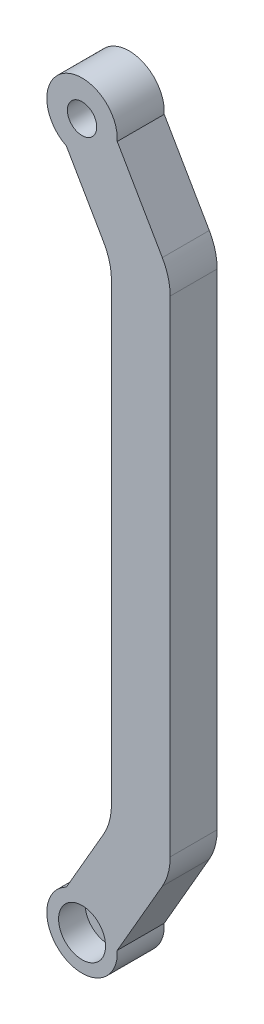
from build123d import *

# Parameters (mm, degrees)
SKETCH_1_R          = 6
EXTRUDE_1_DEPTH     = 8
EXTRUDE_1_2_DEPTH   = 8
EXTRUDE_1_3_DEPTH   = 8
SKETCH_3_R          = 2.5
CUT_EXTRUDE_1_DEPTH = 128.141653285
SKETCH_4_R          = 2
CUT_EXTRUDE_2_DEPTH = 128.141653285
SKETCH_5_R          = 4
CUT_EXTRUDE_3_DEPTH = 4.5
FILLET_1_R          = 10


with BuildPart() as part:
    # 草图1 → Extrude 1 (new body)
    with BuildSketch(Plane.XY):
        Circle(SKETCH_1_R)
    extrude(amount=EXTRUDE_1_DEPTH)



with BuildPart() as body_2:
    # 草图1 → Extrude 1 2 (new body)
    with BuildSketch(Plane.XY):
        with Locations((0, 120)):
            Circle(SKETCH_1_R)
    extrude(amount=EXTRUDE_1_2_DEPTH)


with BuildPart() as part_1:
    add(part.part)

    add(body_2.part)  # Extrude 1 3 merges body 2
    # 草图2 → Extrude 1 3 (add)
    with BuildSketch(Plane.XY):
        Polygon((-4.330127019, 117.5), (5, 101.339745962), (5, 18.660254038), (-4.330127019, 2.5), (4.330127019, -2.5), (15, 15.980762114), (15, 104.019237886), (4.330127019, 122.5), align=None)
    extrude(amount=EXTRUDE_1_3_DEPTH)

    # 草图3 → 切除-拉伸1 (cut, through all)
    with BuildSketch(Plane.XY.offset(8)):
        with Locations((0, 120)):
            Circle(SKETCH_3_R)
    extrude(amount=-CUT_EXTRUDE_1_DEPTH, mode=Mode.SUBTRACT)

    # 草图4 → 切除-拉伸2 (cut, through all)
    with BuildSketch(Plane.XY.offset(8)):
        Circle(SKETCH_4_R)
    extrude(amount=-CUT_EXTRUDE_2_DEPTH, mode=Mode.SUBTRACT)

    # 草图5 → 切除-拉伸3 (cut)
    with BuildSketch(Plane.XY.offset(8)):
        Circle(SKETCH_5_R)
    extrude(amount=-CUT_EXTRUDE_3_DEPTH, mode=Mode.SUBTRACT)

    # 圆角1
    fillet_1_edges = [part_1.edges().sort_by_distance(p)[0] for p in [
        (5, 18.660254038, 4),
        (15, 15.980762114, 4),
        (15, 104.019237886, 4),
        (5, 101.339745962, 4),
    ]]
    fillet(fillet_1_edges, radius=FILLET_1_R)


solid = part_1.part
